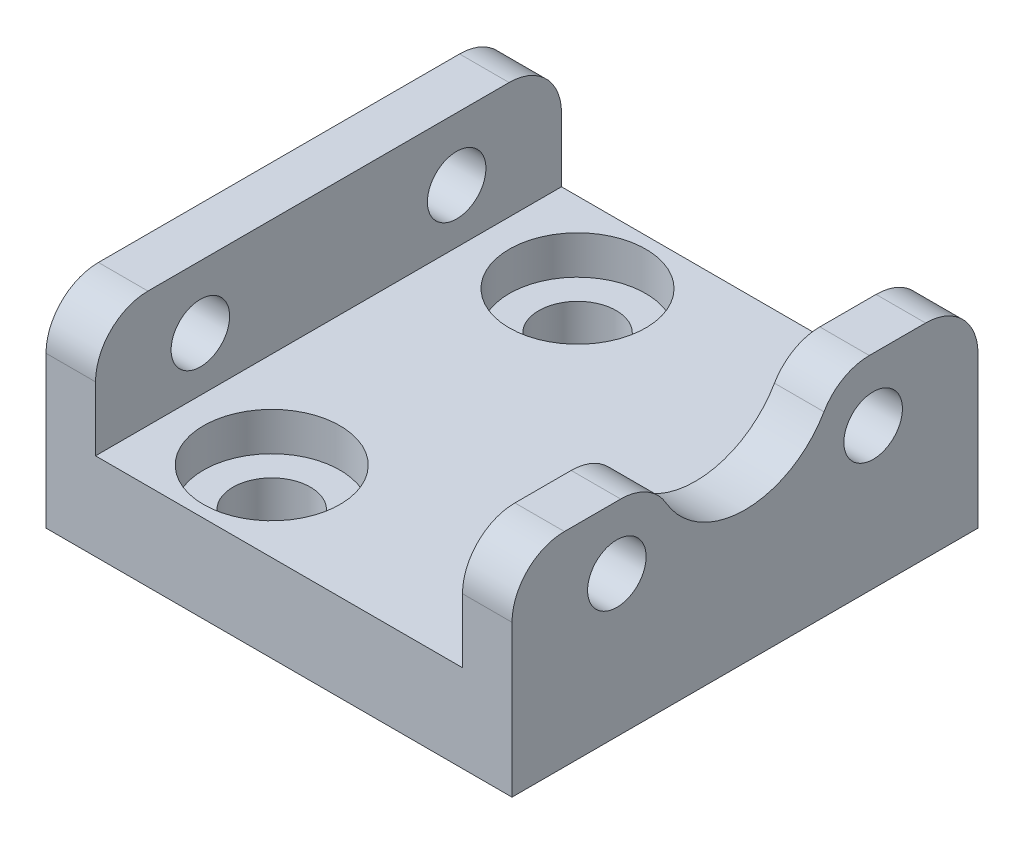
from build123d import *

# Parameters (mm, degrees)
SKETCH1_W                                        = 40.64
SKETCH1_H                                        = 40.64
BOSS_EXTRUDE1_DEPTH                              = 7.62
SKETCH2_W                                        = 4.318
SKETCH2_H                                        = 40.64
BOSS_EXTRUDE2_DEPTH                              = 10.16
F_10_CLEARANCE_HOLE1_D                           = 5.1054
CBORE_FOR_1_4_BUTTON_HEAD_CAP_SCREW1_D           = 6.7564
CBORE_FOR_1_4_BUTTON_HEAD_CAP_SCREW1_CBORE_D     = 11.90752
CBORE_FOR_1_4_BUTTON_HEAD_CAP_SCREW1_CBORE_DEPTH = 3.3528
CUT_EXTRUDE1_REACH                               = 62.161
SKETCH8_R                                        = 7.965368028
FILLET1_R                                        = 4.572


with BuildPart() as part:
    # Sketch1 → Boss-Extrude1 (new body)
    with BuildSketch(Plane(origin=(0, 0, 0), x_dir=(1, 0, 0), z_dir=(0, 1, 0))):
        with Locations((20.32, -20.32)):
            Rectangle(SKETCH1_W, SKETCH1_H)
    extrude(amount=BOSS_EXTRUDE1_DEPTH)

    # Sketch2 → Boss-Extrude2 (add)
    with BuildSketch(Plane(origin=(0, 7.62, 0), x_dir=(1, 0, 0), z_dir=(0, 1, 0))):
        with Locations((2.159, -20.32)):
            Rectangle(SKETCH2_W, SKETCH2_H)
        with Locations((38.481, -20.32)):
            Rectangle(SKETCH2_W, SKETCH2_H)
    extrude(amount=BOSS_EXTRUDE2_DEPTH)

    # #10 Clearance Hole1 (through all)
    with Locations(Plane.ZY):
        with Locations((9.144, 12.319), (31.496, 12.319)):
            Hole(F_10_CLEARANCE_HOLE1_D / 2)

    # CBORE for 1/4 Button Head Cap Screw1 (through all)
    with Locations(Plane(origin=(0, 7.62, 0), x_dir=(1, 0, 0), z_dir=(0, 1, 0))):
        with Locations((12.7, -6.985), (12.7, -33.655)):
            CounterBoreHole(CBORE_FOR_1_4_BUTTON_HEAD_CAP_SCREW1_D / 2, CBORE_FOR_1_4_BUTTON_HEAD_CAP_SCREW1_CBORE_D / 2, CBORE_FOR_1_4_BUTTON_HEAD_CAP_SCREW1_CBORE_DEPTH)

    # Sketch8 → Cut-Extrude1 (cut, up to next)
    with BuildSketch(Plane(origin=(40.64, 0, 0), x_dir=(0, 0, -1), z_dir=(1, 0, 0)), mode=Mode.PRIVATE) as cut_extrude1_sk1:
        with Locations((-20.32, 19.504553012)):
            Circle(SKETCH8_R)
    cut_extrude1_tool1 = extrude(cut_extrude1_sk1.sketch, amount=-CUT_EXTRUDE1_REACH, mode=Mode.PRIVATE) & part.part
    add(cut_extrude1_tool1.solids().sort_by_distance((40.64, 19.504553, 20.32))[0], mode=Mode.SUBTRACT)

    # Fillet1
    fillet1_edges = [part.edges().sort_by_distance(p)[0] for p in [
        (2.159, 17.78, 40.64),
        (2.159, 17.78, 0),
        (38.481, 17.78, 40.64),
        (38.481, 17.78, 0),
        (38.481, 17.78, 28.096439078),
        (38.481, 17.78, 12.543560922),
    ]]
    fillet(fillet1_edges, radius=FILLET1_R)


solid = part.part
